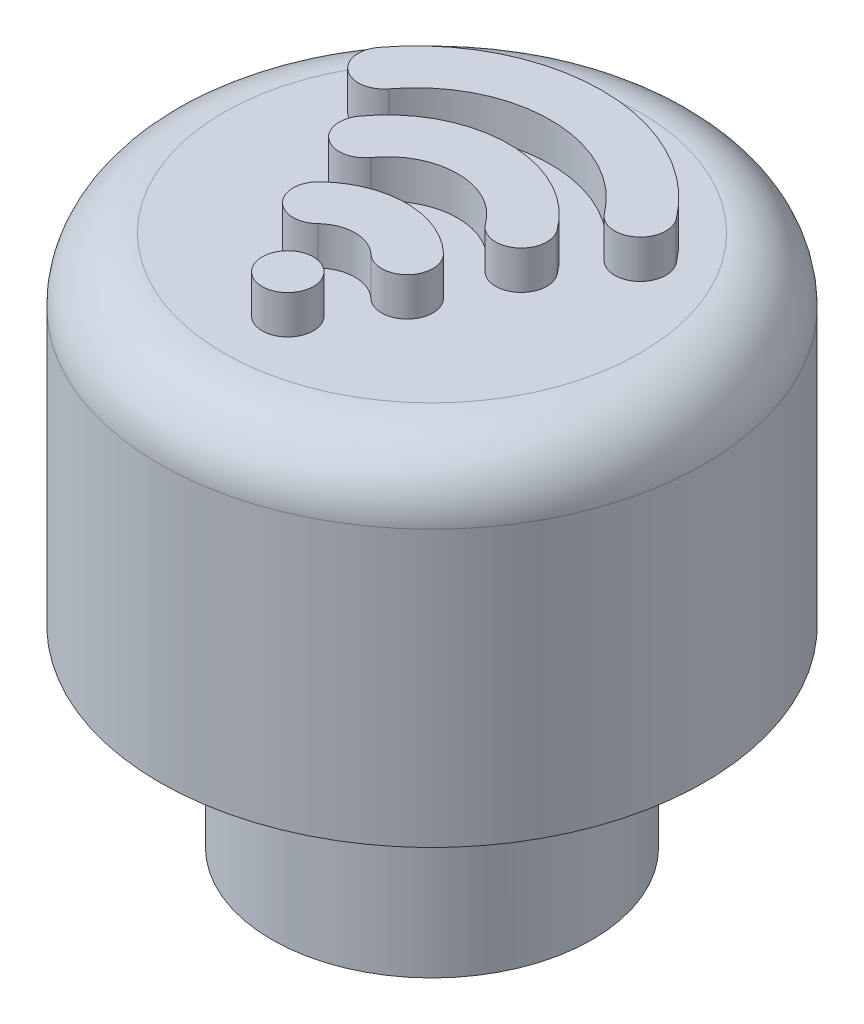
from build123d import *

# Parameters (mm, degrees)
SKETCH1_R           = 4.25
BOSS_EXTRUDE1_DEPTH = 5.3
SKETCH2_R           = 2.5
BOSS_EXTRUDE2_DEPTH = 3
SHELL2_T            = -0.7
FILLET1_R           = 1
SKETCH3_R           = 0.4
BOSS_EXTRUDE4_DEPTH = 0.6


with BuildPart() as part:
    # Sketch1 → Boss-Extrude1 (new body)
    with BuildSketch(Plane(origin=(0, 0, 0), x_dir=(1, 0, 0), z_dir=(0, 1, 0))):
        with Locations(Location((0, 0, 0), (0, 0, 270))):
            Circle(SKETCH1_R)
    extrude(amount=BOSS_EXTRUDE1_DEPTH)

    # Sketch2 → Boss-Extrude2 (add)
    with BuildSketch(Plane.XZ):
        with Locations(Location((0, 0, 0), (0, 0, 90))):
            Circle(SKETCH2_R)
    extrude(amount=BOSS_EXTRUDE2_DEPTH)

    # Shell2
    shell2_openings = [part.faces().sort_by_distance(p)[0] for p in [
        (0, -3, 0),
    ]]
    offset(amount=SHELL2_T, openings=shell2_openings, kind=Kind.INTERSECTION)

    # Fillet1
    fillet1_edges = [part.edges().sort_by_distance(p)[0] for p in [
        (0, 5.3, -4.25),
    ]]
    fillet(fillet1_edges, radius=FILLET1_R)

    # Sketch3 → Boss-Extrude4 (add)
    with BuildSketch(Plane(origin=(0, 5.3, 0), x_dir=(1, 0, 0), z_dir=(0, 1, 0))):
        with Locations(Location((0, -2.25, 0), (0, 0, 270))):
            Circle(SKETCH3_R)
        with BuildLine():
            ThreePointArc((0.966334519, -0.786985884), (0, -0.4), (-0.966334519, -0.786985884))
            ThreePointArc((-0.966334519, -0.786985884), (-0.979671546, -1.352514066), (-0.414143365, -1.365851093))
            ThreePointArc((-0.414143365, -1.365851093), (0, -1.2), (0.414143365, -1.365851093))
            ThreePointArc((0.414143365, -1.365851093), (0.979671546, -1.352514066), (0.966334519, -0.786985884))
        make_face()
        with BuildLine():
            ThreePointArc((1.545056478, 0.405803093), (0, 1.2), (-1.545056478, 0.405803093))
            ThreePointArc((-1.545056478, 0.405803093), (-1.452582081, -0.152272606), (-0.894506382, -0.059798209))
            ThreePointArc((-0.894506382, -0.059798209), (0, 0.4), (0.894506382, -0.059798209))
            ThreePointArc((0.894506382, -0.059798209), (1.452582081, -0.152272606), (1.545056478, 0.405803093))
        make_face()
        with BuildLine():
            ThreePointArc((2.32, 1.49), (0, 2.65), (-2.32, 1.49))
            ThreePointArc((-2.32, 1.49), (-2.24, 0.93), (-1.68, 1.01))
            ThreePointArc((-1.68, 1.01), (0, 1.85), (1.68, 1.01))
            ThreePointArc((1.68, 1.01), (2.24, 0.93), (2.32, 1.49))
        make_face()
    extrude(amount=BOSS_EXTRUDE4_DEPTH)


solid = part.part
